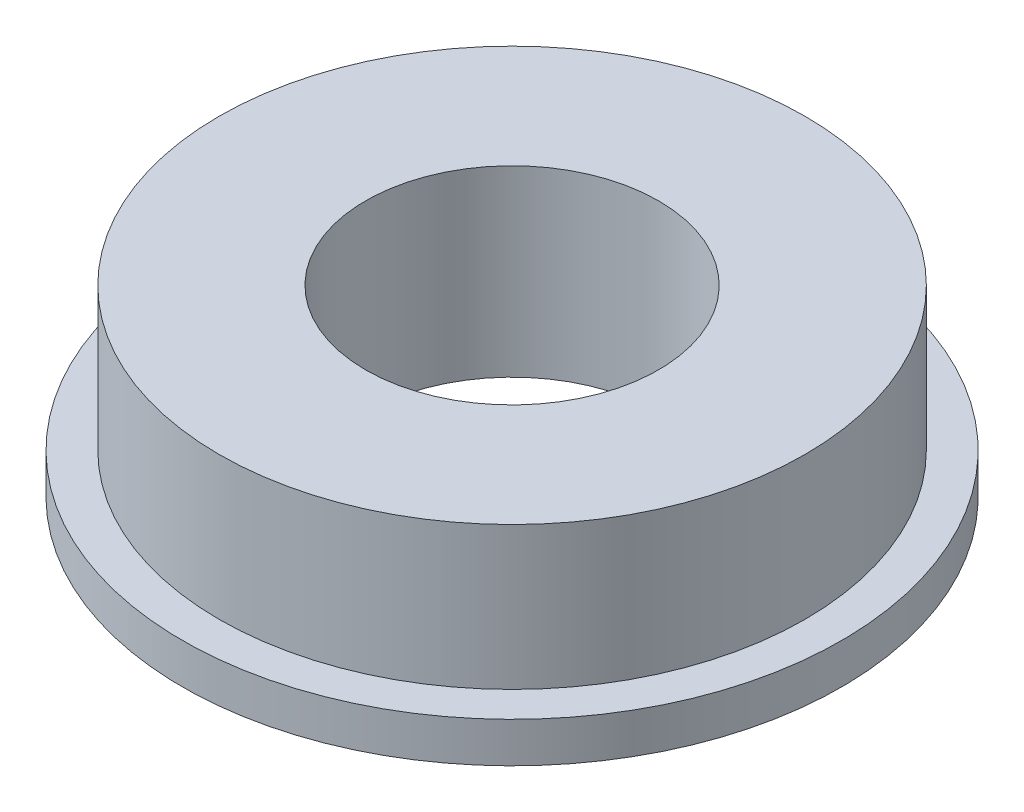
from build123d import *
from build123d.topology import SkipClean

# Parameters (mm, degrees)
SKETCH_1_R      = 8
SKETCH_1_R_2    = 4
EXTRUDE_1_DEPTH = 3.9
EXTRUDE_START   = 1.1
SKETCH_2_R      = 9
SKETCH_2_R_2    = 4
EXTRUDE_2_DEPTH = 1.1


with BuildPart() as part:
    # 草图1 → 凸台-拉伸1 (new body)
    with BuildSketch(Plane(origin=(0, 0, 0), x_dir=(1, 0, 0), z_dir=(0, 1, 0))):
        with Locations(Location((0, 0, 0), (0, 0, 270))):
            Circle(SKETCH_1_R)
        with Locations(Location((0, 0, 0), (0, 0, 270))):
            Circle(SKETCH_1_R_2, mode=Mode.SUBTRACT)
    extrude(amount=EXTRUDE_1_DEPTH)

    # 草图2 → 凸台-拉伸2 (add)
    with SkipClean():  # the faces are left unmerged after this step: merging them gives an invalid solid
        with BuildSketch(Plane.XZ.offset(EXTRUDE_START)):
            with Locations(Location((0, 0, 0), (0, 0, 270))):
                Circle(SKETCH_2_R)
            with Locations(Location((0, 0, 0), (0, 0, 270))):
                Circle(SKETCH_2_R_2, mode=Mode.SUBTRACT)
        extrude(amount=-EXTRUDE_2_DEPTH)


solid = part.part
